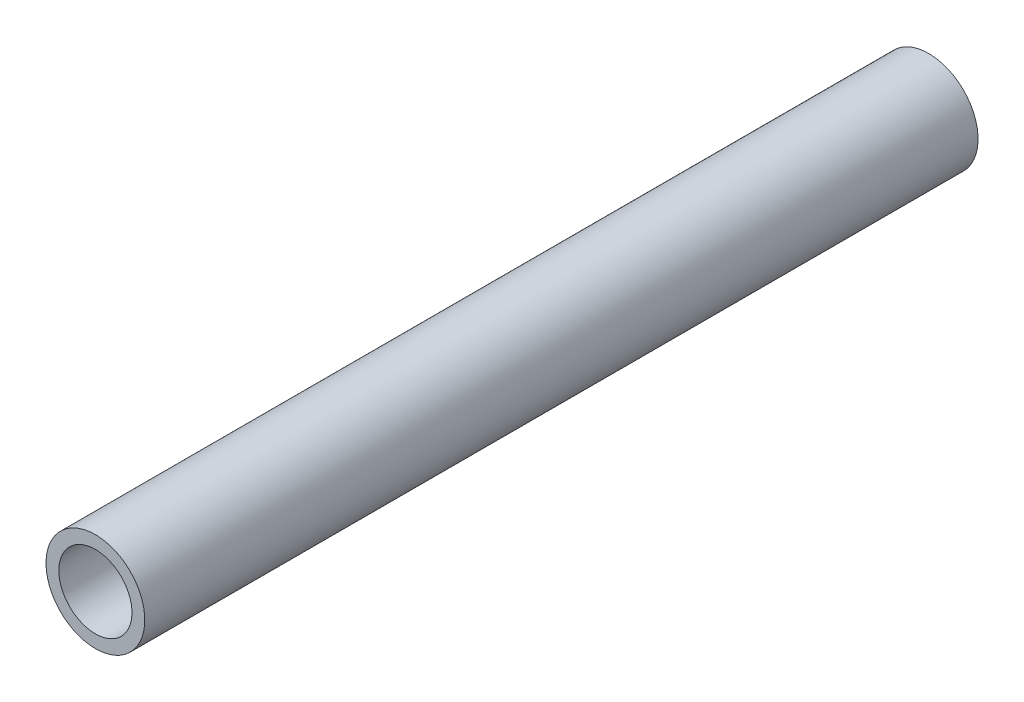
from build123d import *

# Parameters (mm, degrees)
SKETCH1_R           = 10.668
SKETCH1_R_2         = 7.8994
EXTRUDE_THIN1_DEPTH = 90


with BuildPart() as part:
    # Sketch1 → Extrude-Thin1 (new, symmetric)
    with BuildSketch(Plane.XY):
        Circle(SKETCH1_R)
        Circle(SKETCH1_R_2, mode=Mode.SUBTRACT)
    extrude(amount=EXTRUDE_THIN1_DEPTH, both=True)


solid = part.part
